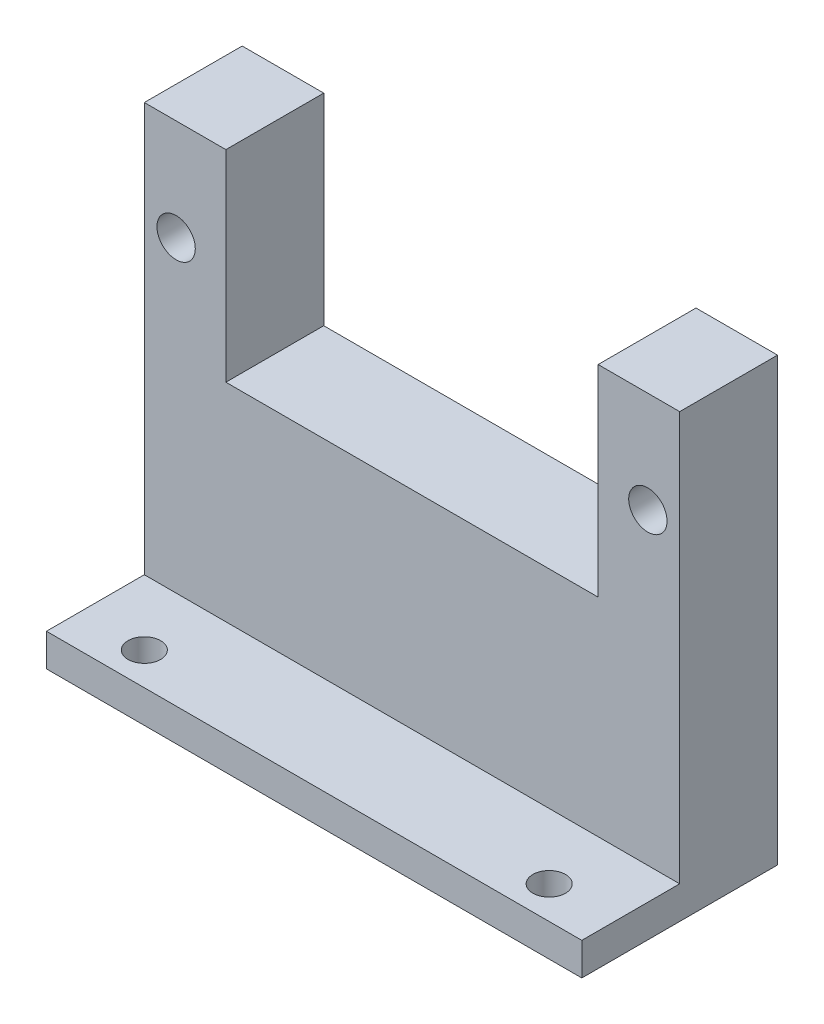
from build123d import *

# Parameters (mm, degrees)
SKETCH1_W                    = 32.82
SKETCH1_H                    = 27.07
BOSS_EXTRUDE1_DEPTH          = 12
SKETCH2_W                    = 6
SKETCH2_H                    = 25.07
CUT_EXTRUDE1_DEPTH           = 45.203362994
SKETCH3_W                    = 22.82
SKETCH3_H                    = 12.35
CUT_EXTRUDE2_DEPTH           = 45.203362994
F_2_35_2_35_DIAMETER_HOLE1_D = 2.35
F_2_0_2_DIAMETER_HOLE1_D     = 2


with BuildPart() as part:
    # Sketch1 → Boss-Extrude1 (new body)
    with BuildSketch(Plane(origin=(0, 0, 0), x_dir=(-1, 0, 0), z_dir=(0, 0, -1))):
        with Locations((-16.41, 13.535)):
            Rectangle(SKETCH1_W, SKETCH1_H)
    extrude(amount=-BOSS_EXTRUDE1_DEPTH)

    # Sketch2 → Cut-Extrude1 (cut, through all)
    with BuildSketch(Plane.ZY):
        with Locations((9, 14.535)):
            Rectangle(SKETCH2_W, SKETCH2_H)
    extrude(amount=-CUT_EXTRUDE1_DEPTH, mode=Mode.SUBTRACT)

    # Sketch3 → Cut-Extrude2 (cut, through all)
    with BuildSketch(Plane(origin=(0, 0, 0), x_dir=(-1, 0, 0), z_dir=(0, 0, -1))):
        with Locations((-16.41, 20.895)):
            Rectangle(SKETCH3_W, SKETCH3_H)
    extrude(amount=-CUT_EXTRUDE2_DEPTH, mode=Mode.SUBTRACT)

    # Ø2.35 (2.35) Diameter Hole1 (through all)
    with Locations(Plane.XY.offset(6)):
        with Locations((1.95, 20.87), (30.87, 20.87)):
            Hole(F_2_35_2_35_DIAMETER_HOLE1_D / 2)

    # Ø2.0 (2) Diameter Hole1 (through all)
    with Locations(Plane(origin=(0, 2, 0), x_dir=(1, 0, 0), z_dir=(0, 1, 0))):
        with Locations((28.82, -10), (4, -10)):
            Hole(F_2_0_2_DIAMETER_HOLE1_D / 2)


solid = part.part
